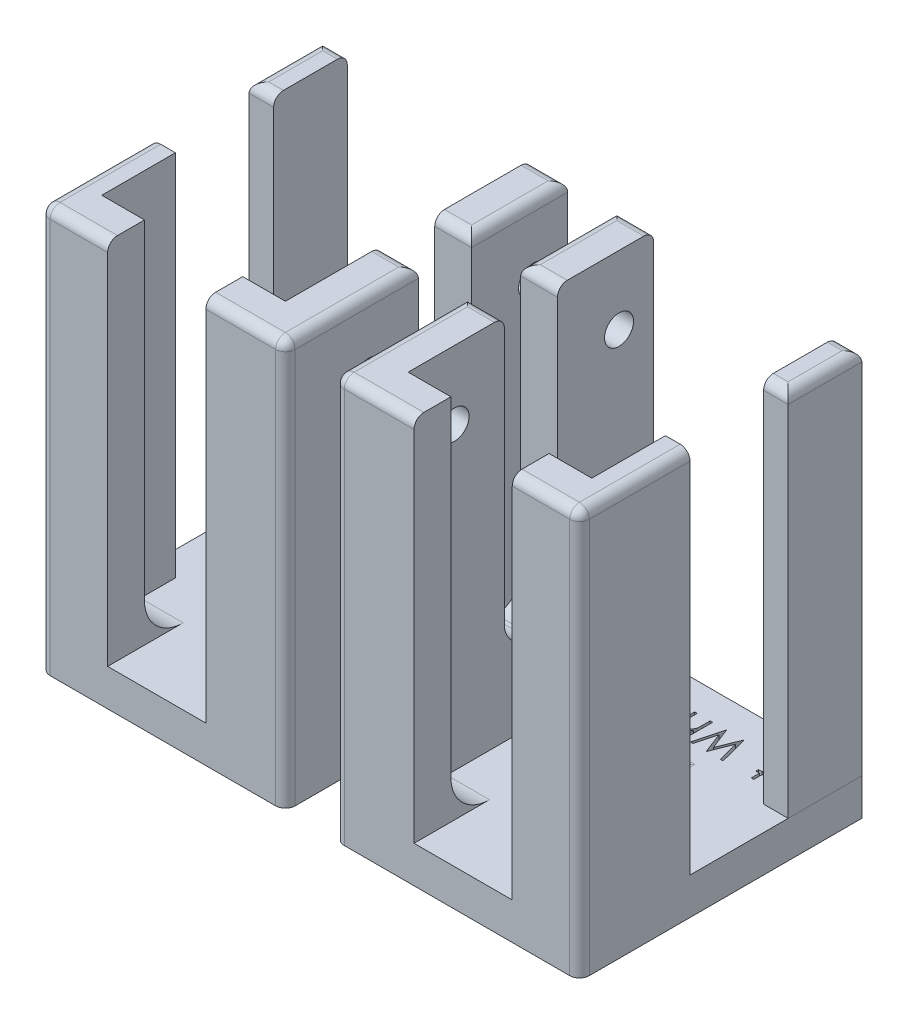
from build123d import *

# Parameters (mm, degrees)
SKETCH2_W             = 2.54
SKETCH2_H             = 7.62
BOSS_EXTRUDE2_DEPTH   = 38.1
BOSS_EXTRUDE2_2_DEPTH = 38.1
SKETCH1_W             = 25.35
SKETCH1_H             = 29.21
BOSS_EXTRUDE3_DEPTH   = 3.81
SKETCH3_W             = 3
SKETCH3_H             = 7.62
CUT_EXTRUDE1_DEPTH    = 44.604428674
SKETCH4_W             = 5.5
SKETCH4_H             = 30.1
CUT_EXTRUDE2_DEPTH    = 47.77779067
SKETCH9_W             = 10.16
SKETCH9_H             = 38.1
CUT_EXTRUDE7_DEPTH    = 3.81
SKETCH5_R             = 1.5
CUT_EXTRUDE3_DEPTH    = 47.77779067
SKETCH6_R             = 1.45
CUT_EXTRUDE4_DEPTH    = 22.054
FILLET1_R             = 4
FILLET4_R             = 2.54
FILLET2_R             = 1.016
FILLET3_R             = 1.27
FILLET5_R             = 1.016
SKETCH7_W             = 0.261191239
SKETCH7_H             = 2.985042735
CUT_EXTRUDE5_DEPTH    = 1.27
SKETCH8_W             = 0.26119124
SKETCH8_H             = 2.985042735
CUT_EXTRUDE6_DEPTH    = 1.27


with BuildPart() as part:
    # Sketch2 → Boss-Extrude2 (new body)
    with BuildSketch(Plane(origin=(0, 0, 0), x_dir=(1, 0, 0), z_dir=(0, 1, 0))):
        with Locations((10.77, -8.89)):
            Rectangle(SKETCH2_W, SKETCH2_H)
    extrude(amount=BOSS_EXTRUDE2_DEPTH)


with BuildPart() as body_2:
    # Sketch2 → Boss-Extrude2 2 (new body)
    with BuildSketch(Plane(origin=(0, 0, 0), x_dir=(1, 0, 0), z_dir=(0, 1, 0))):
        Polygon((-13.31, -12.7), (-13.31, 16.51), (12.04, 16.51), (12.04, 5.08), (9.5, 5.08), (9.5, 12.7), (-9.5, 12.7), (-9.5, -12.7), align=None)
    extrude(amount=BOSS_EXTRUDE2_2_DEPTH)

    # Sketch1 → Boss-Extrude3 (add)
    with BuildSketch(Plane(origin=(0, 0, 0), x_dir=(1, 0, 0), z_dir=(0, 1, 0))):
        with Locations((-0.635, 1.905)):
            Rectangle(SKETCH1_W, SKETCH1_H)
    extrude(amount=-BOSS_EXTRUDE3_DEPTH)

    # Sketch3 → Cut-Extrude1 (cut, through all)
    with BuildSketch(Plane(origin=(0, 0, 0), x_dir=(1, 0, 0), z_dir=(0, 1, 0))):
        with Locations((-0.38, 0)):
            Rectangle(SKETCH3_W, SKETCH3_H)
    extrude(amount=-CUT_EXTRUDE1_DEPTH, mode=Mode.SUBTRACT)

    # Sketch4 → Cut-Extrude2 (cut, through all)
    with BuildSketch(Plane(origin=(-9.5, 0, 0), x_dir=(0, 0, -1), z_dir=(1, 0, 0))):
        with Locations((0, 23.05)):
            Rectangle(SKETCH4_W, SKETCH4_H)
    extrude(amount=-CUT_EXTRUDE2_DEPTH, mode=Mode.SUBTRACT)

    # Sketch9 → Cut-Extrude7 (cut)
    with BuildSketch(Plane.XY.offset(-12.7)):
        with Locations((0, 19.05)):
            Rectangle(SKETCH9_W, SKETCH9_H)
    extrude(amount=-CUT_EXTRUDE7_DEPTH, mode=Mode.SUBTRACT)

    # Sketch5 → Cut-Extrude3 (cut, through all)
    with BuildSketch(Plane(origin=(-9.5, 0, 0), x_dir=(0, 0, -1), z_dir=(1, 0, 0))):
        with Locations((-9.1179944, 31)):
            Circle(SKETCH5_R)
        with Locations((7.9000056, 31)):
            Circle(SKETCH5_R)
    extrude(amount=-CUT_EXTRUDE3_DEPTH, mode=Mode.SUBTRACT)

    # Sketch6 → Cut-Extrude4 (cut)
    with BuildSketch(Plane.XY.offset(12.7)):
        with Locations(Location((-11.405, 19.05, 0), (0, 0, 90))):
            Circle(SKETCH6_R)
        with Locations((-3.81, -1.905)):
            Circle(SKETCH6_R)
    extrude(amount=-CUT_EXTRUDE4_DEPTH, mode=Mode.SUBTRACT)

    # Fillet1
    fillet1_edges = [body_2.edges().sort_by_distance(p)[0] for p in [
        (-7.29, 0, -12.7),
        (7.29, 0, -12.7),
    ]]
    fillet(fillet1_edges, radius=FILLET1_R)


with BuildPart() as body_3:
    # Mirror1: mirrored copy
    add(body_2.part.mirror(Plane.XY))

    # Fillet4
    fillet4_edges = [body_3.edges().sort_by_distance(p)[0] for p in [
        (-11.405, 8, -2.75),
        (-11.405, 8, 2.75),
    ]]
    fillet(fillet4_edges, radius=FILLET4_R)

    # Fillet2
    fillet2_edges = [body_3.edges().sort_by_distance(p)[0] for p in [
        (-13.31, 17.145, 16.51),
        (12.04, 17.145, 16.51),
        (12.04, 38.1, 10.795),
        (8.56, 38.1, 16.51),
        (-13.31, 38.1, 9.63),
        (-11.405, 38.1, -12.7),
        (-13.31, 38.1, -7.725),
        (-11.405, 38.1, -2.75),
        (-11.405, 38.1, 2.75),
        (-9.195, 38.1, 16.51),
    ]]
    fillet(fillet2_edges, radius=FILLET2_R)

    # Fillet3
    fillet3_edges = [body_3.edges().sort_by_distance(p)[0] for p in [
        (-1.88, 0, 0),
        (-0.38, 0, -3.81),
        (1.12, 0, 0),
        (-0.38, 0, 3.81),
    ]]
    fillet(fillet3_edges, radius=FILLET3_R)


with BuildPart() as body_4:
    # Mirror1 2: mirrored copy
    add(part.part.mirror(Plane.XY))

    # Fillet5
    fillet5_edges = [body_4.edges().sort_by_distance(p)[0] for p in [
        (10.77, 38.1, -12.7),
        (12.04, 38.1, -8.89),
        (10.77, 38.1, -5.08),
    ]]
    fillet(fillet5_edges, radius=FILLET5_R)


with BuildPart() as body_3_2:
    # Mirror3: mirrored copy
    add(body_3.part.mirror(Plane.ZY.offset(15.85)))

    # Sketch8 → Cut-Extrude6 (cut)
    # profile 1 of 8: a face of its own
    with BuildSketch(Plane(origin=(0, 0, 0), x_dir=(1, 0, 0), z_dir=(0, 1, 0))):
        with Locations((-40.665007096, 8.312855295)):
            Rectangle(SKETCH8_W, SKETCH8_H)
    # profile 2 of 8: a face of its own
    with BuildSketch(Plane(origin=(0, 0, 0), x_dir=(1, 0, 0), z_dir=(0, 1, 0))):
        with BuildLine():
            Line((-39.705362498, 9.133742047), (-39.937402929, 9.255592424))
            add(Edge.make_bspline(
                [(-39.937402929, 9.255592424), (-39.918899777, 9.288380971), (-39.882899969, 9.352174499), (-39.821288232, 9.439868181), (-39.756031538, 9.518018678), (-39.685833051, 9.58625911), (-39.61157339, 9.646192558), (-39.532146677, 9.697546688), (-39.448874524, 9.742134152), (-39.360549092, 9.778475368), (-39.267254655, 9.807079868), (-39.168416464, 9.828195291), (-39.063577149, 9.840442417), (-38.991782959, 9.841928663), (-38.955020701, 9.842689697)],
                knots=[0, 0, 0, 0, 1.120547187, 2.180141081, 3.186367408, 4.148075574, 5.090720713, 6.023293347, 6.960451315, 7.899733127, 8.862572377, 9.862522039, 10.90550313, 12, 12, 12, 12], degree=3))
            add(Edge.make_bspline(
                [(-38.955020701, 9.842689697), (-38.914156807, 9.841735766), (-38.834443188, 9.839874923), (-38.71840924, 9.823832321), (-38.60916101, 9.797661551), (-38.506704567, 9.761102128), (-38.411291081, 9.713348508), (-38.322729951, 9.655174109), (-38.240559074, 9.586876312), (-38.167354153, 9.507869095), (-38.101490996, 9.423302792), (-38.043229028, 9.335242104), (-37.995084336, 9.243724162), (-37.953990936, 9.150138449), (-37.923585468, 9.053239428), (-37.900884963, 8.953880828), (-37.888165754, 8.851698798), (-37.886184487, 8.782604618), (-37.885186049, 8.74778535)],
                knots=[0, 0, 0, 0, 1.145213001, 2.233978795, 3.276616913, 4.289988888, 5.2768102, 6.260573508, 7.254647871, 8.264498533, 9.273731702, 10.25749501, 11.220258744, 12.169609138, 13.119022067, 14.062790212, 15.023763961, 16, 16, 16, 16], degree=3))
            add(Edge.make_bspline(
                [(-37.885186049, 8.74778535), (-37.886066775, 8.715109827), (-37.887812259, 8.650351256), (-37.898814289, 8.554502467), (-37.918312661, 8.461345474), (-37.945068807, 8.370802871), (-37.979620646, 8.283026256), (-38.021890057, 8.197962207), (-38.071942886, 8.115701243), (-38.110587127, 8.063810066), (-38.130052836, 8.037671668)],
                knots=[0, 0, 0, 0, 1.024358464, 2.0301432, 3.019427413, 4.004406732, 4.986367066, 5.972626655, 6.978780325, 8, 8, 8, 8], degree=3))
            add(Edge.make_bspline(
                [(-38.130052836, 8.037671668), (-38.156373829, 8.006129687), (-38.208097485, 7.944146213), (-38.296488303, 7.863444664), (-38.390910352, 7.794411387), (-38.492313405, 7.738093903), (-38.600526654, 7.694776853), (-38.714991943, 7.663966009), (-38.836025652, 7.644794094), (-38.918995583, 7.642429927), (-38.961433879, 7.64122068)],
                knots=[0, 0, 0, 0, 1.030811313, 2.025658015, 2.997072178, 3.962767568, 4.930766827, 5.917075773, 6.934604948, 8, 8, 8, 8], degree=3))
            add(Edge.make_bspline(
                [(-38.961433879, 7.64122068), (-39.005049068, 7.642340996), (-39.090612127, 7.644538803), (-39.215335547, 7.665096449), (-39.333583204, 7.697301237), (-39.444379259, 7.744222084), (-39.549430916, 7.80238368), (-39.646320423, 7.875897212), (-39.73770746, 7.960986941), (-39.790844921, 8.026492776), (-39.817884617, 8.059826282)],
                knots=[0, 0, 0, 0, 1.056389096, 2.072394598, 3.055233004, 4.020130009, 4.981825462, 5.957811105, 6.960805292, 8, 8, 8, 8], degree=3))
            add(Edge.make_bspline(
                [(-39.817884617, 8.059826282), (-39.83628422, 8.084941998), (-39.872960952, 8.135006253), (-39.918901547, 8.216640245), (-39.958780404, 8.302048995), (-39.990656087, 8.392613093), (-40.01646691, 8.487259494), (-40.035140824, 8.586664812), (-40.046091989, 8.690799447), (-40.048244614, 8.761752541), (-40.049342032, 8.797924739)],
                knots=[0, 0, 0, 0, 0.94817472, 1.890038105, 2.849395472, 3.817997239, 4.812318967, 5.836947057, 6.897266129, 8, 8, 8, 8], degree=3))
            Line((-40.049342032, 8.797924739), (-38.146377288, 8.797924739))
            add(Edge.make_bspline(
                [(-38.146377288, 8.797924739), (-38.14765876, 8.825947713), (-38.150178723, 8.881053762), (-38.161898856, 8.961697642), (-38.18046239, 9.038481281), (-38.206266241, 9.111077524), (-38.238621608, 9.179724727), (-38.277010331, 9.244896), (-38.32308897, 9.305601592), (-38.374399278, 9.362628172), (-38.431540323, 9.413393691), (-38.491633447, 9.458866409), (-38.555467387, 9.496768048), (-38.62239864, 9.527996084), (-38.692774316, 9.552031272), (-38.766495449, 9.568582719), (-38.843332706, 9.579639919), (-38.895707815, 9.580871476), (-38.922371796, 9.581498457)],
                knots=[0, 0, 0, 0, 1.094405546, 2.152104367, 3.174987145, 4.173015398, 5.153654967, 6.133208507, 7.119289451, 8.123438607, 9.122504012, 10.097966803, 11.060604936, 12.014205423, 12.976096155, 13.956823727, 14.959826266, 16, 16, 16, 16], degree=3))
            add(Edge.make_bspline(
                [(-38.922371796, 9.581498457), (-38.948443571, 9.581000421), (-39.000174973, 9.58001222), (-39.077372782, 9.570120525), (-39.153497698, 9.554703325), (-39.227562611, 9.532333059), (-39.298381398, 9.505876924), (-39.364516228, 9.474943489), (-39.425346082, 9.440077658), (-39.482091202, 9.399839098), (-39.536832197, 9.350967774), (-39.591309047, 9.289866002), (-39.649198667, 9.217170419), (-39.685936722, 9.162598001), (-39.705362498, 9.133742047)],
                knots=[0, 0, 0, 0, 0.991026944, 1.966387566, 2.954903586, 3.941705208, 4.905318989, 5.827751054, 6.715113263, 7.568237245, 8.468614997, 9.499196909, 10.677664282, 12, 12, 12, 12], degree=3))
        make_face()
        with BuildLine():
            add(Edge.make_bspline(
                [(-39.788150793, 8.5367335), (-39.778645761, 8.50206325), (-39.760399189, 8.435507634), (-39.721294458, 8.34359198), (-39.679296653, 8.260962923), (-39.62772219, 8.189709881), (-39.569355663, 8.126764921), (-39.501729857, 8.07208942), (-39.427078918, 8.021937854), (-39.344045698, 7.980130261), (-39.255839385, 7.945786563), (-39.16429132, 7.920530282), (-39.070163288, 7.905684576), (-39.006765955, 7.903507933), (-38.974843251, 7.902411919)],
                knots=[0, 0, 0, 0, 1.154958961, 2.217145986, 3.207012531, 4.129872728, 5.036522214, 5.960144231, 6.920619777, 7.92424629, 8.943461387, 9.961007416, 10.973298156, 12, 12, 12, 12], degree=3))
            add(Edge.make_bspline(
                [(-38.974843251, 7.902411919), (-38.948773445, 7.902916797), (-38.897238922, 7.903914834), (-38.821335856, 7.913507062), (-38.748121077, 7.929125126), (-38.677945575, 7.951471136), (-38.610650836, 7.97956989), (-38.545928105, 8.013386526), (-38.484556414, 8.054532588), (-38.446190422, 8.085937697), (-38.426808061, 8.101803445)],
                knots=[0, 0, 0, 0, 1.04879286, 2.073242986, 3.073461291, 4.057960153, 5.032623303, 6.005244481, 6.992256684, 8, 8, 8, 8], degree=3))
            add(Edge.make_bspline(
                [(-38.426808061, 8.101803445), (-38.412924627, 8.114353768), (-38.384827939, 8.139752563), (-38.347325401, 8.183536845), (-38.311150261, 8.230777522), (-38.279003378, 8.283536693), (-38.248452537, 8.340284399), (-38.220612801, 8.401434714), (-38.195299623, 8.467245755), (-38.181089802, 8.513127818), (-38.173779048, 8.5367335)],
                knots=[0, 0, 0, 0, 0.879905587, 1.780714457, 2.708106151, 3.677566983, 4.684151534, 5.740052498, 6.837288539, 8, 8, 8, 8], degree=3))
            Line((-38.173779048, 8.5367335), (-39.788150793, 8.5367335))
        make_face(mode=Mode.SUBTRACT)
    # profile 3 of 8: a face of its own
    with BuildSketch(Plane(origin=(0, 0, 0), x_dir=(1, 0, 0), z_dir=(0, 1, 0))):
        with BuildLine():
            Line((-37.093450105, 9.133742047), (-37.325490536, 9.255592424))
            add(Edge.make_bspline(
                [(-37.325490536, 9.255592424), (-37.306987383, 9.288380971), (-37.270987576, 9.352174499), (-37.209375838, 9.439868181), (-37.144119145, 9.518018678), (-37.073920657, 9.58625911), (-36.999660997, 9.646192558), (-36.920234284, 9.697546688), (-36.836962131, 9.742134152), (-36.748636699, 9.778475368), (-36.655342262, 9.807079868), (-36.556504071, 9.828195291), (-36.451664756, 9.840442417), (-36.379870566, 9.841928663), (-36.343108308, 9.842689697)],
                knots=[0, 0, 0, 0, 1.120547187, 2.180141081, 3.186367408, 4.148075574, 5.090720713, 6.023293347, 6.960451315, 7.899733127, 8.862572377, 9.862522039, 10.90550313, 12, 12, 12, 12], degree=3))
            add(Edge.make_bspline(
                [(-36.343108308, 9.842689697), (-36.302244414, 9.841735766), (-36.222530795, 9.839874923), (-36.106496847, 9.823832321), (-35.997248617, 9.797661551), (-35.894792173, 9.761102128), (-35.799378688, 9.713348508), (-35.710817557, 9.655174109), (-35.628646681, 9.586876312), (-35.55544176, 9.507869095), (-35.489578603, 9.423302792), (-35.431316635, 9.335242104), (-35.383171943, 9.243724162), (-35.342078542, 9.150138449), (-35.311673075, 9.053239428), (-35.288972569, 8.953880828), (-35.276253361, 8.851698798), (-35.274272094, 8.782604618), (-35.273273656, 8.74778535)],
                knots=[0, 0, 0, 0, 1.145213001, 2.233978795, 3.276616913, 4.289988888, 5.2768102, 6.260573508, 7.254647871, 8.264498533, 9.273731702, 10.25749501, 11.220258744, 12.169609138, 13.119022067, 14.062790212, 15.023763961, 16, 16, 16, 16], degree=3))
            add(Edge.make_bspline(
                [(-35.273273656, 8.74778535), (-35.274154382, 8.715109827), (-35.275899866, 8.650351256), (-35.286901896, 8.554502467), (-35.306400268, 8.461345474), (-35.333156413, 8.370802871), (-35.367708253, 8.283026256), (-35.409977664, 8.197962207), (-35.460030493, 8.115701243), (-35.498674734, 8.063810066), (-35.518140443, 8.037671668)],
                knots=[0, 0, 0, 0, 1.024358464, 2.0301432, 3.019427413, 4.004406732, 4.986367066, 5.972626655, 6.978780325, 8, 8, 8, 8], degree=3))
            add(Edge.make_bspline(
                [(-35.518140443, 8.037671668), (-35.544461436, 8.006129687), (-35.596185092, 7.944146213), (-35.68457591, 7.863444664), (-35.778997959, 7.794411387), (-35.880401012, 7.738093903), (-35.988614261, 7.694776853), (-36.10307955, 7.663966009), (-36.224113259, 7.644794094), (-36.30708319, 7.642429927), (-36.349521486, 7.64122068)],
                knots=[0, 0, 0, 0, 1.030811313, 2.025658015, 2.997072178, 3.962767568, 4.930766827, 5.917075773, 6.934604948, 8, 8, 8, 8], degree=3))
            add(Edge.make_bspline(
                [(-36.349521486, 7.64122068), (-36.393136675, 7.642340996), (-36.478699734, 7.644538803), (-36.603423154, 7.665096449), (-36.721670811, 7.697301237), (-36.832466866, 7.744222084), (-36.937518523, 7.80238368), (-37.03440803, 7.875897212), (-37.125795067, 7.960986941), (-37.178932527, 8.026492776), (-37.205972224, 8.059826282)],
                knots=[0, 0, 0, 0, 1.056389096, 2.072394598, 3.055233004, 4.020130009, 4.981825462, 5.957811105, 6.960805292, 8, 8, 8, 8], degree=3))
            add(Edge.make_bspline(
                [(-37.205972224, 8.059826282), (-37.224371826, 8.084941998), (-37.261048559, 8.135006253), (-37.306989153, 8.216640245), (-37.346868011, 8.302048995), (-37.378743694, 8.392613093), (-37.404554517, 8.487259494), (-37.423228431, 8.586664812), (-37.434179596, 8.690799447), (-37.436332221, 8.761752541), (-37.437429639, 8.797924739)],
                knots=[0, 0, 0, 0, 0.94817472, 1.890038105, 2.849395472, 3.817997239, 4.812318967, 5.836947057, 6.897266129, 8, 8, 8, 8], degree=3))
            Line((-37.437429639, 8.797924739), (-35.534464895, 8.797924739))
            add(Edge.make_bspline(
                [(-35.534464895, 8.797924739), (-35.535746367, 8.825947713), (-35.53826633, 8.881053762), (-35.549986463, 8.961697642), (-35.568549997, 9.038481281), (-35.594353848, 9.111077524), (-35.626709214, 9.179724727), (-35.665097937, 9.244896), (-35.711176577, 9.305601592), (-35.762486885, 9.362628172), (-35.81962793, 9.413393691), (-35.879721054, 9.458866409), (-35.943554994, 9.496768048), (-36.010486247, 9.527996084), (-36.080861923, 9.552031272), (-36.154583056, 9.568582719), (-36.231420313, 9.579639919), (-36.283795422, 9.580871476), (-36.310459403, 9.581498457)],
                knots=[0, 0, 0, 0, 1.094405546, 2.152104367, 3.174987145, 4.173015398, 5.153654967, 6.133208507, 7.119289451, 8.123438607, 9.122504012, 10.097966803, 11.060604936, 12.014205423, 12.976096155, 13.956823727, 14.959826266, 16, 16, 16, 16], degree=3))
            add(Edge.make_bspline(
                [(-36.310459403, 9.581498457), (-36.336531178, 9.581000421), (-36.38826258, 9.58001222), (-36.465460389, 9.570120525), (-36.541585305, 9.554703325), (-36.615650218, 9.532333059), (-36.686469005, 9.505876924), (-36.752603835, 9.474943489), (-36.813433689, 9.440077658), (-36.870178809, 9.399839098), (-36.924919803, 9.350967774), (-36.979396654, 9.289866002), (-37.037286274, 9.217170419), (-37.074024328, 9.162598001), (-37.093450105, 9.133742047)],
                knots=[0, 0, 0, 0, 0.991026944, 1.966387566, 2.954903586, 3.941705208, 4.905318989, 5.827751054, 6.715113263, 7.568237245, 8.468614997, 9.499196909, 10.677664282, 12, 12, 12, 12], degree=3))
        make_face()
        with BuildLine():
            add(Edge.make_bspline(
                [(-37.176238399, 8.5367335), (-37.166733368, 8.50206325), (-37.148486796, 8.435507634), (-37.109382065, 8.34359198), (-37.06738426, 8.260962923), (-37.015809797, 8.189709881), (-36.95744327, 8.126764921), (-36.889817464, 8.07208942), (-36.815166525, 8.021937854), (-36.732133305, 7.980130261), (-36.643926992, 7.945786563), (-36.552378927, 7.920530282), (-36.458250895, 7.905684576), (-36.394853562, 7.903507933), (-36.362930857, 7.902411919)],
                knots=[0, 0, 0, 0, 1.154958961, 2.217145986, 3.207012531, 4.129872728, 5.036522214, 5.960144231, 6.920619777, 7.92424629, 8.943461387, 9.961007416, 10.973298156, 12, 12, 12, 12], degree=3))
            add(Edge.make_bspline(
                [(-36.362930857, 7.902411919), (-36.336861052, 7.902916797), (-36.285326529, 7.903914834), (-36.209423463, 7.913507062), (-36.136208684, 7.929125126), (-36.066033182, 7.951471136), (-35.998738443, 7.97956989), (-35.934015712, 8.013386526), (-35.872644021, 8.054532588), (-35.834278029, 8.085937697), (-35.814895668, 8.101803445)],
                knots=[0, 0, 0, 0, 1.04879286, 2.073242986, 3.073461291, 4.057960153, 5.032623303, 6.005244481, 6.992256684, 8, 8, 8, 8], degree=3))
            add(Edge.make_bspline(
                [(-35.814895668, 8.101803445), (-35.801012233, 8.114353768), (-35.772915546, 8.139752563), (-35.735413008, 8.183536845), (-35.699237868, 8.230777522), (-35.667090984, 8.283536693), (-35.636540144, 8.340284399), (-35.608700407, 8.401434714), (-35.58338723, 8.467245755), (-35.569177409, 8.513127818), (-35.561866655, 8.5367335)],
                knots=[0, 0, 0, 0, 0.879905587, 1.780714457, 2.708106151, 3.677566983, 4.684151534, 5.740052498, 6.837288539, 8, 8, 8, 8], degree=3))
            Line((-35.561866655, 8.5367335), (-37.176238399, 8.5367335))
        make_face(mode=Mode.SUBTRACT)
    # profile 4 of 8: a face of its own
    with BuildSketch(Plane(origin=(0, 0, 0), x_dir=(1, 0, 0), z_dir=(0, 1, 0))):
        with BuildLine():
            Line((-32.885239468, 6.820333927), (-33.146430707, 6.820333927))
            Line((-33.146430707, 6.820333927), (-33.146430707, 8.080231847))
            add(Edge.make_bspline(
                [(-33.146430707, 8.080231847), (-33.174512892, 8.045235849), (-33.229103586, 7.977204965), (-33.320362505, 7.887481712), (-33.415454965, 7.811058838), (-33.515187957, 7.748652234), (-33.61913761, 7.700239868), (-33.727559356, 7.666370299), (-33.84017678, 7.645249988), (-33.916891622, 7.642573275), (-33.955657136, 7.64122068)],
                knots=[0, 0, 0, 0, 1.12556596, 2.18805719, 3.205172764, 4.182516927, 5.13416184, 6.075333115, 7.027428072, 8, 8, 8, 8], degree=3))
            add(Edge.make_bspline(
                [(-33.955657136, 7.64122068), (-33.995033594, 7.642589914), (-34.072141454, 7.64527118), (-34.184006067, 7.668896527), (-34.289215324, 7.706284047), (-34.386363839, 7.758829447), (-34.473951511, 7.824071211), (-34.549919652, 7.900588562), (-34.613648507, 7.987373695), (-34.656287833, 8.068267571), (-34.684233727, 8.140205623), (-34.701899055, 8.201942229), (-34.716884886, 8.270727786), (-34.729939347, 8.34653611), (-34.738640501, 8.429728279), (-34.745629285, 8.519929834), (-34.750599008, 8.61713534), (-34.750791596, 8.684424383), (-34.750891177, 8.719217558)],
                knots=[0, 0, 0, 0, 1.235689485, 2.419754739, 3.574485241, 4.732583367, 5.875375667, 6.993392835, 8.106934443, 9.24564317, 9.854426656, 10.528623913, 11.260290605, 12.06517837, 12.94359002, 13.886555271, 14.907200199, 16, 16, 16, 16], degree=3))
            Line((-34.750891177, 8.719217558), (-34.750891177, 9.805376662))
            Line((-34.750891177, 9.805376662), (-34.489699938, 9.805376662))
            Line((-34.489699938, 9.805376662), (-34.489699938, 8.804920933))
            add(Edge.make_bspline(
                [(-34.489699938, 8.804920933), (-34.489542324, 8.775964188), (-34.489240837, 8.720574863), (-34.488231988, 8.641273885), (-34.486031141, 8.569540632), (-34.482343194, 8.505226197), (-34.478632258, 8.44841774), (-34.473371117, 8.399022469), (-34.46729559, 8.357350257), (-34.461832984, 8.332266956), (-34.459383098, 8.321017521)],
                knots=[0, 0, 0, 0, 1.430934443, 2.737134061, 3.918973087, 4.976914145, 5.92044225, 6.731742364, 7.431207999, 8, 8, 8, 8], degree=3))
            add(Edge.make_bspline(
                [(-34.459383098, 8.321017521), (-34.449927398, 8.28798562), (-34.431796895, 8.22464975), (-34.388814032, 8.138770515), (-34.336378005, 8.064885376), (-34.271384111, 8.005092895), (-34.195991472, 7.957980086), (-34.109484334, 7.925882104), (-34.012968101, 7.905412871), (-33.945081745, 7.903442036), (-33.90959886, 7.902411919)],
                knots=[0, 0, 0, 0, 1.090171874, 2.090312098, 3.036871164, 3.954896932, 4.878889889, 5.844924892, 6.87358393, 8, 8, 8, 8], degree=3))
            add(Edge.make_bspline(
                [(-33.90959886, 7.902411919), (-33.888585635, 7.902801896), (-33.847001006, 7.90357365), (-33.785370099, 7.911518063), (-33.72539959, 7.924065193), (-33.66725044, 7.942598421), (-33.610804033, 7.965131322), (-33.555830918, 7.992783699), (-33.503083438, 8.026218399), (-33.451880775, 8.063848822), (-33.40421613, 8.105478017), (-33.359872712, 8.14942438), (-33.320342157, 8.196219273), (-33.284528615, 8.24511448), (-33.253613089, 8.296779996), (-33.226626809, 8.350717773), (-33.203729565, 8.406998698), (-33.192351755, 8.446060699), (-33.186658822, 8.465605529)],
                knots=[0, 0, 0, 0, 1.024369801, 2.02720137, 3.025498567, 4.008789058, 4.999724648, 5.987391013, 7.005161842, 8.042127274, 9.083588116, 10.088924978, 11.084112559, 12.068088063, 13.041783903, 14.016724555, 15.007660144, 16, 16, 16, 16], degree=3))
            add(Edge.make_bspline(
                [(-33.186658822, 8.465605529), (-33.183383001, 8.47975926), (-33.176244583, 8.510601982), (-33.168498855, 8.561471346), (-33.161565581, 8.620583049), (-33.155704376, 8.687847435), (-33.152109524, 8.763510986), (-33.148235975, 8.847057373), (-33.146794059, 8.939009926), (-33.146555444, 9.002952202), (-33.146430707, 9.036378349)],
                knots=[0, 0, 0, 0, 0.607992626, 1.324890765, 2.152360218, 3.099583803, 4.150613268, 5.323148443, 6.60066238, 8, 8, 8, 8], degree=3))
            Line((-33.146430707, 9.036378349), (-33.146430707, 9.805376662))
            Line((-33.146430707, 9.805376662), (-32.885239468, 9.805376662))
            Line((-32.885239468, 9.805376662), (-32.885239468, 6.820333927))
        make_face()
    # profile 5 of 8: a face of its own
    with BuildSketch(Plane(origin=(0, 0, 0), x_dir=(1, 0, 0), z_dir=(0, 1, 0))):
        Polygon((-28.89274481, 6.894959996), (-29.162681291, 6.894959996), (-29.732288079, 9.029382155), (-30.579410558, 6.894959996), (-30.617306609, 6.894959996), (-31.448687652, 9.014806751), (-32.02120952, 6.894959996), (-32.288230921, 6.894959996), (-31.503491171, 9.805376662), (-31.466178136, 9.805376662), (-30.590487865, 7.579420967), (-29.704303303, 9.805376662), (-29.666990269, 9.805376662), align=None)
    # profile 6 of 8: a face of its own
    with BuildSketch(Plane(origin=(0, 0, 0), x_dir=(1, 0, 0), z_dir=(0, 1, 0))):
        with BuildLine():
            add(Edge.make_bspline(
                [(-27.045749617, 9.357620252), (-27.061967874, 9.358551499), (-27.093574948, 9.360366365), (-27.139342947, 9.373704732), (-27.181166637, 9.396210396), (-27.218190709, 9.427133409), (-27.248962457, 9.46405128), (-27.271727081, 9.505768726), (-27.285676841, 9.551669412), (-27.287401154, 9.583732425), (-27.28828434, 9.600154974)],
                knots=[0, 0, 0, 0, 1.020591893, 1.988988293, 2.974634352, 3.991697318, 5.008760285, 5.983632262, 6.967224335, 8, 8, 8, 8], degree=3))
            add(Edge.make_bspline(
                [(-27.28828434, 9.600154974), (-27.287368954, 9.616185394), (-27.285560712, 9.647851717), (-27.271720543, 9.693365143), (-27.248991319, 9.735129951), (-27.21799586, 9.771960459), (-27.181390352, 9.803627705), (-27.13921036, 9.825821102), (-27.09369295, 9.840136912), (-27.061989143, 9.841825009), (-27.045749617, 9.842689697)],
                knots=[0, 0, 0, 0, 1.010056097, 1.99525427, 2.971718109, 3.990441831, 5.01702829, 6.004283803, 6.977741589, 8, 8, 8, 8], degree=3))
            add(Edge.make_bspline(
                [(-27.045749617, 9.842689697), (-27.029521779, 9.841792438), (-26.997654416, 9.840030449), (-26.951966671, 9.826105716), (-26.910042211, 9.803411144), (-26.873427188, 9.77201761), (-26.842680885, 9.734938153), (-26.818896451, 9.693649494), (-26.806160539, 9.64772009), (-26.804206032, 9.616159467), (-26.803214895, 9.600154974)],
                knots=[0, 0, 0, 0, 1.021821805, 2.006599202, 2.982645994, 4.008793999, 5.027082625, 6.009034913, 6.990375297, 8, 8, 8, 8], degree=3))
            add(Edge.make_bspline(
                [(-26.803214895, 9.600154974), (-26.804176508, 9.583759269), (-26.806050743, 9.551803164), (-26.818890658, 9.505484637), (-26.8427098, 9.464243278), (-26.873232984, 9.427076705), (-26.910263666, 9.39642355), (-26.951836606, 9.373424057), (-26.997770572, 9.360471311), (-27.029542578, 9.358583323), (-27.045749617, 9.357620252)],
                knots=[0, 0, 0, 0, 1.032329927, 2.012066096, 2.992413168, 4.009037178, 5.025661188, 6.000112418, 6.979848586, 8, 8, 8, 8], degree=3))
        make_face()
    # profile 7 of 8: a face of its own
    with BuildSketch(Plane(origin=(0, 0, 0), x_dir=(1, 0, 0), z_dir=(0, 1, 0))):
        Polygon((-25.646510835, 6.820333927), (-25.907702075, 6.820333927), (-25.907702075, 7.678533714), (-26.280832417, 7.678533714), (-26.280832417, 7.939724953), (-25.907702075, 7.939724953), (-25.907702075, 9.805376662), (-25.646510835, 9.805376662), (-25.646510835, 7.939724953), (-25.273380493, 7.939724953), (-25.273380493, 7.678533714), (-25.646510835, 7.678533714), align=None)
    # profile 8 of 8: a face of its own
    with BuildSketch(Plane(origin=(0, 0, 0), x_dir=(1, 0, 0), z_dir=(0, 1, 0))):
        with BuildLine():
            Line((-22.997285408, 6.894959996), (-23.579718551, 6.894959996))
            add(Edge.make_bspline(
                [(-23.579718551, 6.894959996), (-23.618586025, 6.895089373), (-23.693215881, 6.895337791), (-23.800130678, 6.896722953), (-23.897277972, 6.900693057), (-23.984606969, 6.90410954), (-24.062116068, 6.910339446), (-24.13004294, 6.916293865), (-24.188074734, 6.92408851), (-24.223204171, 6.931327484), (-24.239109827, 6.934605095)],
                knots=[0, 0, 0, 0, 1.410062039, 2.707475311, 3.878576406, 4.937260626, 5.877586885, 6.699081471, 7.410979367, 8, 8, 8, 8], degree=3))
            add(Edge.make_bspline(
                [(-24.239109827, 6.934605095), (-24.260403313, 6.939865519), (-24.302536037, 6.950274148), (-24.363192289, 6.972285017), (-24.421015949, 6.997715513), (-24.475795265, 7.027812712), (-24.527515882, 7.062068386), (-24.57617259, 7.100620243), (-24.621112998, 7.143798594), (-24.663936016, 7.189814822), (-24.701328691, 7.240672417), (-24.734992018, 7.293790491), (-24.763251227, 7.350191699), (-24.785488072, 7.409591566), (-24.804129869, 7.471407409), (-24.816658898, 7.536250054), (-24.824462196, 7.603908534), (-24.825233162, 7.64994408), (-24.825624083, 7.673286568)],
                knots=[0, 0, 0, 0, 1.027276577, 2.032638556, 3.019345632, 3.985365262, 4.957888996, 5.923693931, 6.890056973, 7.876427719, 8.865527834, 9.843495157, 10.821038291, 11.815616373, 12.812734995, 13.843357168, 14.906466538, 16, 16, 16, 16], degree=3))
            add(Edge.make_bspline(
                [(-24.825624083, 7.673286568), (-24.824402573, 7.712065923), (-24.82201909, 7.787734489), (-24.799795451, 7.897548777), (-24.76339481, 7.999988837), (-24.713227157, 8.094912109), (-24.649370184, 8.180518291), (-24.572628623, 8.255454678), (-24.483394388, 8.318741871), (-24.399933155, 8.362162463), (-24.326172899, 8.390101134), (-24.265270626, 8.409857568), (-24.198786096, 8.424864488), (-24.127673129, 8.438503682), (-24.051382443, 8.448911483), (-23.970067669, 8.456302999), (-23.883525432, 8.461055801), (-23.824203023, 8.461750205), (-23.793685481, 8.462107432)],
                knots=[0, 0, 0, 0, 1.260402266, 2.459371274, 3.627181936, 4.786749125, 5.93865593, 7.087644312, 8.261344208, 9.485713728, 10.136162886, 10.825977872, 11.566646758, 12.35154167, 13.181268117, 14.0701832, 15.007234106, 16, 16, 16, 16], degree=3))
            Line((-23.793685481, 8.462107432), (-24.862937117, 9.805376662))
            Line((-24.862937117, 9.805376662), (-24.539946165, 9.805376662))
            Line((-24.539946165, 9.805376662), (-23.470694529, 8.462107432))
            Line((-23.470694529, 8.462107432), (-23.258476647, 8.462107432))
            Line((-23.258476647, 8.462107432), (-23.258476647, 9.805376662))
            Line((-23.258476647, 9.805376662), (-22.997285408, 9.805376662))
            Line((-22.997285408, 9.805376662), (-22.997285408, 6.894959996))
        make_face()
        with BuildLine():
            Line((-23.258476647, 7.193464269), (-23.258476647, 8.163603158))
            Line((-23.258476647, 8.163603158), (-23.791353417, 8.167684271))
            add(Edge.make_bspline(
                [(-23.791353417, 8.167684271), (-23.816233357, 8.167695285), (-23.864457768, 8.167716631), (-23.934225123, 8.164395531), (-23.999185861, 8.160617836), (-24.059090694, 8.154838153), (-24.113969079, 8.147393945), (-24.163784767, 8.138067719), (-24.208647845, 8.127248232), (-24.260804708, 8.110331129), (-24.319715971, 8.084684703), (-24.382419086, 8.044917692), (-24.437251164, 7.996825353), (-24.482837983, 7.941137005), (-24.519453367, 7.87964556), (-24.544886014, 7.81374266), (-24.561645979, 7.74446667), (-24.563493179, 7.696900387), (-24.564432844, 7.672703552)],
                knots=[0, 0, 0, 0, 1.146399208, 2.222048177, 3.218135709, 4.144938032, 4.994811973, 5.769438708, 6.479732432, 7.119818093, 8.294689872, 9.430121864, 10.527913442, 11.641375077, 12.733452768, 13.811150417, 14.886538365, 16, 16, 16, 16], degree=3))
            add(Edge.make_bspline(
                [(-24.564432844, 7.672703552), (-24.5634456, 7.649293759), (-24.561489243, 7.60290409), (-24.545152869, 7.535143658), (-24.518478156, 7.470712381), (-24.481967322, 7.410496874), (-24.436525673, 7.356241853), (-24.383596386, 7.309962242), (-24.324425004, 7.27151446), (-24.269569284, 7.246146521), (-24.220179817, 7.231219985), (-24.177495196, 7.22038483), (-24.128844722, 7.212796378), (-24.074801004, 7.205817029), (-24.015126632, 7.19990659), (-23.949785242, 7.195983532), (-23.878823552, 7.193638714), (-23.829640076, 7.193523771), (-23.804179772, 7.193464269)],
                knots=[0, 0, 0, 0, 1.100596872, 2.180981401, 3.259506136, 4.371595435, 5.481727359, 6.576991111, 7.667816242, 8.793363246, 9.406619729, 10.09427138, 10.864108636, 11.721733836, 12.6590937, 13.685439239, 14.801845161, 16, 16, 16, 16], degree=3))
            Line((-23.804179772, 7.193464269), (-23.258476647, 7.193464269))
        make_face(mode=Mode.SUBTRACT)
    extrude(amount=-CUT_EXTRUDE6_DEPTH, mode=Mode.SUBTRACT)


with BuildPart() as body_4_2:
    # Mirror3 2: mirrored copy
    add(body_4.part.mirror(Plane.ZY.offset(15.85)))


with BuildPart() as body_3_1:
    add(body_3.part)

    # Sketch7 → Cut-Extrude5 (cut)
    # profile 1 of 8: a face of its own
    with BuildSketch(Plane(origin=(0, 0, 0), x_dir=(1, 0, 0), z_dir=(0, 1, 0))):
        Polygon((8.822853296, 6.86371087), (8.561662057, 6.86371087), (8.561662057, 9.475623264), (7.442271031, 9.475623264), (7.442271031, 9.774127537), (8.822853296, 9.774127537), align=None)
    # profile 2 of 8: a face of its own
    with BuildSketch(Plane(origin=(0, 0, 0), x_dir=(1, 0, 0), z_dir=(0, 1, 0))):
        Polygon((6.770636416, 6.789084802), (6.509445177, 6.789084802), (6.509445177, 7.647284588), (6.136314835, 7.647284588), (6.136314835, 7.908475828), (6.509445177, 7.908475828), (6.509445177, 9.774127537), (6.770636416, 9.774127537), (6.770636416, 7.908475828), (7.143766758, 7.908475828), (7.143766758, 7.647284588), (6.770636416, 7.647284588), align=None)
    # profile 3 of 8: a face of its own
    with BuildSketch(Plane(origin=(0, 0, 0), x_dir=(1, 0, 0), z_dir=(0, 1, 0))):
        with BuildLine():
            add(Edge.make_bspline(
                [(5.371397634, 9.326371127), (5.355179377, 9.327302373), (5.323572303, 9.32911724), (5.277804304, 9.342455606), (5.235980615, 9.364961271), (5.198956542, 9.395884284), (5.168184794, 9.432802154), (5.145420171, 9.4745196), (5.13147041, 9.520420287), (5.129746098, 9.552483299), (5.128862912, 9.568905849)],
                knots=[0, 0, 0, 0, 1.020591893, 1.988988293, 2.974634352, 3.991697318, 5.008760285, 5.983632262, 6.967224335, 8, 8, 8, 8], degree=3))
            add(Edge.make_bspline(
                [(5.128862912, 9.568905849), (5.129778297, 9.584936269), (5.13158654, 9.616602592), (5.145426708, 9.662116017), (5.168155932, 9.703880825), (5.199151391, 9.740711334), (5.2357569, 9.772378579), (5.277936891, 9.794571977), (5.323454301, 9.808887787), (5.355158108, 9.810575884), (5.371397634, 9.811440571)],
                knots=[0, 0, 0, 0, 1.010056097, 1.99525427, 2.971718109, 3.990441831, 5.01702829, 6.004283803, 6.977741589, 8, 8, 8, 8], degree=3))
            add(Edge.make_bspline(
                [(5.371397634, 9.811440571), (5.387625472, 9.810543313), (5.419492836, 9.808781324), (5.46518058, 9.79485659), (5.50710504, 9.772162018), (5.543720064, 9.740768484), (5.574466366, 9.703689027), (5.5982508, 9.662400368), (5.610986712, 9.616470964), (5.612941219, 9.584910341), (5.613932356, 9.568905849)],
                knots=[0, 0, 0, 0, 1.021821805, 2.006599202, 2.982645994, 4.008793999, 5.027082625, 6.009034913, 6.990375297, 8, 8, 8, 8], degree=3))
            add(Edge.make_bspline(
                [(5.613932356, 9.568905849), (5.612970743, 9.552510143), (5.611096508, 9.520554039), (5.598256594, 9.474235512), (5.574437451, 9.432994152), (5.543914268, 9.39582758), (5.506883586, 9.365174424), (5.465310645, 9.342174931), (5.41937668, 9.329222185), (5.387604673, 9.327334198), (5.371397634, 9.326371127)],
                knots=[0, 0, 0, 0, 1.032329927, 2.012066096, 2.992413168, 4.009037178, 5.025661188, 6.000112418, 6.979848586, 8, 8, 8, 8], degree=3))
        make_face()
    # profile 4 of 8: a face of its own
    with BuildSketch(Plane(origin=(0, 0, 0), x_dir=(1, 0, 0), z_dir=(0, 1, 0))):
        Polygon((3.524402442, 6.86371087), (3.25446596, 6.86371087), (2.684859172, 8.998133029), (1.837736693, 6.86371087), (1.799840643, 6.86371087), (0.9684596, 8.983557625), (0.395937731, 6.86371087), (0.12891633, 6.86371087), (0.913656081, 9.774127537), (0.950969115, 9.774127537), (1.826659386, 7.548171841), (2.712843948, 9.774127537), (2.750156982, 9.774127537), align=None)
    # profile 5 of 8: a face of its own
    with BuildSketch(Plane(origin=(0, 0, 0), x_dir=(1, 0, 0), z_dir=(0, 1, 0))):
        with BuildLine():
            Line((-0.468092217, 6.789084802), (-0.729283456, 6.789084802))
            Line((-0.729283456, 6.789084802), (-0.729283456, 8.048982722))
            add(Edge.make_bspline(
                [(-0.729283456, 8.048982722), (-0.757365641, 8.013986723), (-0.811956335, 7.94595584), (-0.903215253, 7.856232587), (-0.998307714, 7.779809713), (-1.098040705, 7.717403109), (-1.201990359, 7.668990742), (-1.310412105, 7.635121173), (-1.423029529, 7.614000862), (-1.499744371, 7.61132415), (-1.538509885, 7.609971554)],
                knots=[0, 0, 0, 0, 1.12556596, 2.18805719, 3.205172764, 4.182516927, 5.13416184, 6.075333115, 7.027428072, 8, 8, 8, 8], degree=3))
            add(Edge.make_bspline(
                [(-1.538509885, 7.609971554), (-1.577886343, 7.611340789), (-1.654994203, 7.614022054), (-1.766858815, 7.637647401), (-1.872068073, 7.675034922), (-1.969216587, 7.727580322), (-2.05680426, 7.792822085), (-2.132772401, 7.869339436), (-2.196501255, 7.956124569), (-2.239140582, 8.037018445), (-2.267086476, 8.108956497), (-2.284751804, 8.170693104), (-2.299737635, 8.239478661), (-2.312792096, 8.315286984), (-2.32149325, 8.398479154), (-2.328482034, 8.488680708), (-2.333451757, 8.585886215), (-2.333644345, 8.653175257), (-2.333743926, 8.687968432)],
                knots=[0, 0, 0, 0, 1.235689485, 2.419754739, 3.574485241, 4.732583367, 5.875375667, 6.993392835, 8.106934443, 9.24564317, 9.854426656, 10.528623913, 11.260290605, 12.06517837, 12.94359002, 13.886555271, 14.907200199, 16, 16, 16, 16], degree=3))
            Line((-2.333743926, 8.687968432), (-2.333743926, 9.774127537))
            Line((-2.333743926, 9.774127537), (-2.072552687, 9.774127537))
            Line((-2.072552687, 9.774127537), (-2.072552687, 8.773671808))
            add(Edge.make_bspline(
                [(-2.072552687, 8.773671808), (-2.072395073, 8.744715063), (-2.072093585, 8.689325737), (-2.071084737, 8.61002476), (-2.06888389, 8.538291507), (-2.065195943, 8.473977072), (-2.061485006, 8.417168614), (-2.056223866, 8.367773343), (-2.050148339, 8.326101132), (-2.044685732, 8.30101783), (-2.042235846, 8.289768396)],
                knots=[0, 0, 0, 0, 1.430934443, 2.737134061, 3.918973087, 4.976914145, 5.92044225, 6.731742364, 7.431207999, 8, 8, 8, 8], degree=3))
            add(Edge.make_bspline(
                [(-2.042235846, 8.289768396), (-2.032780146, 8.256736494), (-2.014649644, 8.193400625), (-1.971666781, 8.10752139), (-1.919230753, 8.033636251), (-1.85423686, 7.97384377), (-1.778844221, 7.926730961), (-1.692337083, 7.894632979), (-1.59582085, 7.874163745), (-1.527934494, 7.872192911), (-1.492451608, 7.871162793)],
                knots=[0, 0, 0, 0, 1.090171874, 2.090312098, 3.036871164, 3.954896932, 4.878889889, 5.844924892, 6.87358393, 8, 8, 8, 8], degree=3))
            add(Edge.make_bspline(
                [(-1.492451608, 7.871162793), (-1.471438384, 7.87155277), (-1.429853755, 7.872324524), (-1.368222847, 7.880268938), (-1.308252339, 7.892816067), (-1.250103189, 7.911349295), (-1.193656781, 7.933882196), (-1.138683667, 7.961534574), (-1.085936186, 7.994969274), (-1.034733524, 8.032599697), (-0.987068879, 8.074228892), (-0.942725461, 8.118175254), (-0.903194906, 8.164970148), (-0.867381364, 8.213865355), (-0.836465838, 8.26553087), (-0.809479558, 8.319468648), (-0.786582314, 8.375749573), (-0.775204504, 8.414811574), (-0.769511571, 8.434356403)],
                knots=[0, 0, 0, 0, 1.024369801, 2.02720137, 3.025498567, 4.008789058, 4.999724648, 5.987391013, 7.005161842, 8.042127274, 9.083588116, 10.088924978, 11.084112559, 12.068088063, 13.041783903, 14.016724555, 15.007660144, 16, 16, 16, 16], degree=3))
            add(Edge.make_bspline(
                [(-0.769511571, 8.434356403), (-0.76623575, 8.448510134), (-0.759097332, 8.479352857), (-0.751351604, 8.53022222), (-0.744418329, 8.589333924), (-0.738557125, 8.65659831), (-0.734962272, 8.732261861), (-0.731088723, 8.815808247), (-0.729646808, 8.9077608), (-0.729408193, 8.971703076), (-0.729283456, 9.005129223)],
                knots=[0, 0, 0, 0, 0.607992626, 1.324890765, 2.152360218, 3.099583803, 4.150613268, 5.323148443, 6.60066238, 8, 8, 8, 8], degree=3))
            Line((-0.729283456, 9.005129223), (-0.729283456, 9.774127537))
            Line((-0.729283456, 9.774127537), (-0.468092217, 9.774127537))
            Line((-0.468092217, 9.774127537), (-0.468092217, 6.789084802))
        make_face()
    # profile 6 of 8: a face of its own
    with BuildSketch(Plane(origin=(0, 0, 0), x_dir=(1, 0, 0), z_dir=(0, 1, 0))):
        with BuildLine():
            Line((-4.676302854, 9.102492922), (-4.908343285, 9.224343299))
            add(Edge.make_bspline(
                [(-4.908343285, 9.224343299), (-4.889840132, 9.257131846), (-4.853840324, 9.320925373), (-4.792228587, 9.408619056), (-4.726971893, 9.486769552), (-4.656773406, 9.555009985), (-4.582513745, 9.614943433), (-4.503087033, 9.666297562), (-4.41981488, 9.710885027), (-4.331489447, 9.747226242), (-4.23819501, 9.775830742), (-4.13935682, 9.796946165), (-4.034517505, 9.809193291), (-3.962723315, 9.810679538), (-3.925961057, 9.811440571)],
                knots=[0, 0, 0, 0, 1.120547187, 2.180141081, 3.186367408, 4.148075574, 5.090720713, 6.023293347, 6.960451315, 7.899733127, 8.862572377, 9.862522039, 10.90550313, 12, 12, 12, 12], degree=3))
            add(Edge.make_bspline(
                [(-3.925961057, 9.811440571), (-3.885097163, 9.81048664), (-3.805383543, 9.808625797), (-3.689349595, 9.792583196), (-3.580101365, 9.766412426), (-3.477644922, 9.729853002), (-3.382231436, 9.682099383), (-3.293670306, 9.623924984), (-3.211499429, 9.555627187), (-3.138294509, 9.47661997), (-3.072431351, 9.392053667), (-3.014169384, 9.303992978), (-2.966024691, 9.212475037), (-2.924931291, 9.118889324), (-2.894525823, 9.021990303), (-2.871825318, 8.922631703), (-2.85910611, 8.820449673), (-2.857124843, 8.751355493), (-2.856126405, 8.716536224)],
                knots=[0, 0, 0, 0, 1.145213001, 2.233978795, 3.276616913, 4.289988888, 5.2768102, 6.260573508, 7.254647871, 8.264498533, 9.273731702, 10.25749501, 11.220258744, 12.169609138, 13.119022067, 14.062790212, 15.023763961, 16, 16, 16, 16], degree=3))
            add(Edge.make_bspline(
                [(-2.856126405, 8.716536224), (-2.857007131, 8.683860702), (-2.858752615, 8.619102131), (-2.869754644, 8.523253342), (-2.889253017, 8.430096349), (-2.916009162, 8.339553745), (-2.950561002, 8.25177713), (-2.992830413, 8.166713082), (-3.042883241, 8.084452118), (-3.081527483, 8.03256094), (-3.100993191, 8.006422542)],
                knots=[0, 0, 0, 0, 1.024358464, 2.0301432, 3.019427413, 4.004406732, 4.986367066, 5.972626655, 6.978780325, 8, 8, 8, 8], degree=3))
            add(Edge.make_bspline(
                [(-3.100993191, 8.006422542), (-3.127314184, 7.974880562), (-3.179037841, 7.912897088), (-3.267428659, 7.832195538), (-3.361850708, 7.763162261), (-3.463253761, 7.706844777), (-3.57146701, 7.663527728), (-3.685932299, 7.632716883), (-3.806966007, 7.613544969), (-3.889935939, 7.611180802), (-3.932374234, 7.609971554)],
                knots=[0, 0, 0, 0, 1.030811313, 2.025658015, 2.997072178, 3.962767568, 4.930766827, 5.917075773, 6.934604948, 8, 8, 8, 8], degree=3))
            add(Edge.make_bspline(
                [(-3.932374234, 7.609971554), (-3.975989424, 7.611091871), (-4.061552482, 7.613289677), (-4.186275903, 7.633847324), (-4.30452356, 7.666052112), (-4.415319614, 7.712972959), (-4.520371271, 7.771134554), (-4.617260779, 7.844648087), (-4.708647816, 7.929737816), (-4.761785276, 7.99524365), (-4.788824972, 8.028577156)],
                knots=[0, 0, 0, 0, 1.056389096, 2.072394598, 3.055233004, 4.020130009, 4.981825462, 5.957811105, 6.960805292, 8, 8, 8, 8], degree=3))
            add(Edge.make_bspline(
                [(-4.788824972, 8.028577156), (-4.807224575, 8.053692873), (-4.843901308, 8.103757127), (-4.889841902, 8.185391119), (-4.92972076, 8.270799869), (-4.961596442, 8.361363968), (-4.987407266, 8.456010368), (-5.00608118, 8.555415687), (-5.017032345, 8.659550322), (-5.01918497, 8.730503416), (-5.020282388, 8.766675614)],
                knots=[0, 0, 0, 0, 0.94817472, 1.890038105, 2.849395472, 3.817997239, 4.812318967, 5.836947057, 6.897266129, 8, 8, 8, 8], degree=3))
            Line((-5.020282388, 8.766675614), (-3.117317644, 8.766675614))
            add(Edge.make_bspline(
                [(-3.117317644, 8.766675614), (-3.118599116, 8.794698588), (-3.121119078, 8.849804636), (-3.132839212, 8.930448516), (-3.151402746, 9.007232156), (-3.177206596, 9.079828398), (-3.209561963, 9.148475601), (-3.247950686, 9.213646874), (-3.294029326, 9.274352467), (-3.345339634, 9.331379047), (-3.402480678, 9.382144566), (-3.462573803, 9.427617283), (-3.526407742, 9.465518923), (-3.593338995, 9.496746958), (-3.663714672, 9.520782146), (-3.737435805, 9.537333593), (-3.814273062, 9.548390793), (-3.866648171, 9.54962235), (-3.893312152, 9.550249332)],
                knots=[0, 0, 0, 0, 1.094405546, 2.152104367, 3.174987145, 4.173015398, 5.153654967, 6.133208507, 7.119289451, 8.123438607, 9.122504012, 10.097966803, 11.060604936, 12.014205423, 12.976096155, 13.956823727, 14.959826266, 16, 16, 16, 16], degree=3))
            add(Edge.make_bspline(
                [(-3.893312152, 9.550249332), (-3.919383926, 9.549751295), (-3.971115329, 9.548763095), (-4.048313138, 9.5388714), (-4.124438053, 9.523454199), (-4.198502966, 9.501083934), (-4.269321754, 9.474627799), (-4.335456583, 9.443694364), (-4.396286437, 9.408828532), (-4.453031557, 9.368589973), (-4.507772552, 9.319718648), (-4.562249402, 9.258616877), (-4.620139023, 9.185921293), (-4.656877077, 9.131348875), (-4.676302854, 9.102492922)],
                knots=[0, 0, 0, 0, 0.991026944, 1.966387566, 2.954903586, 3.941705208, 4.905318989, 5.827751054, 6.715113263, 7.568237245, 8.468614997, 9.499196909, 10.677664282, 12, 12, 12, 12], degree=3))
        make_face()
        with BuildLine():
            add(Edge.make_bspline(
                [(-4.759091148, 8.505484375), (-4.749586117, 8.470814125), (-4.731339545, 8.404258508), (-4.692234814, 8.312342854), (-4.650237009, 8.229713797), (-4.598662546, 8.158460756), (-4.540296019, 8.095515796), (-4.472670212, 8.040840295), (-4.398019274, 7.990688729), (-4.314986054, 7.948881135), (-4.226779741, 7.914537437), (-4.135231676, 7.889281157), (-4.041103644, 7.874435451), (-3.977706311, 7.872258807), (-3.945783606, 7.871162793)],
                knots=[0, 0, 0, 0, 1.154958961, 2.217145986, 3.207012531, 4.129872728, 5.036522214, 5.960144231, 6.920619777, 7.92424629, 8.943461387, 9.961007416, 10.973298156, 12, 12, 12, 12], degree=3))
            add(Edge.make_bspline(
                [(-3.945783606, 7.871162793), (-3.919713801, 7.871667671), (-3.868179277, 7.872665709), (-3.792276211, 7.882257937), (-3.719061433, 7.897876), (-3.64888593, 7.92022201), (-3.581591192, 7.948320764), (-3.516868461, 7.9821374), (-3.45549677, 8.023283463), (-3.417130778, 8.054688572), (-3.397748416, 8.07055432)],
                knots=[0, 0, 0, 0, 1.04879286, 2.073242986, 3.073461291, 4.057960153, 5.032623303, 6.005244481, 6.992256684, 8, 8, 8, 8], degree=3))
            add(Edge.make_bspline(
                [(-3.397748416, 8.07055432), (-3.383864982, 8.083104643), (-3.355768295, 8.108503438), (-3.318265757, 8.15228772), (-3.282090616, 8.199528397), (-3.249943733, 8.252287567), (-3.219392893, 8.309035273), (-3.191553156, 8.370185588), (-3.166239978, 8.435996629), (-3.152030158, 8.481878693), (-3.144719403, 8.505484375)],
                knots=[0, 0, 0, 0, 0.879905587, 1.780714457, 2.708106151, 3.677566983, 4.684151534, 5.740052498, 6.837288539, 8, 8, 8, 8], degree=3))
            Line((-3.144719403, 8.505484375), (-4.759091148, 8.505484375))
        make_face(mode=Mode.SUBTRACT)
    # profile 7 of 8: a face of its own
    with BuildSketch(Plane(origin=(0, 0, 0), x_dir=(1, 0, 0), z_dir=(0, 1, 0))):
        with BuildLine():
            Line((-7.288215247, 9.102492922), (-7.520255678, 9.224343299))
            add(Edge.make_bspline(
                [(-7.520255678, 9.224343299), (-7.501752525, 9.257131846), (-7.465752717, 9.320925373), (-7.40414098, 9.408619056), (-7.338884286, 9.486769552), (-7.268685799, 9.555009985), (-7.194426139, 9.614943433), (-7.114999426, 9.666297562), (-7.031727273, 9.710885027), (-6.943401841, 9.747226242), (-6.850107403, 9.775830742), (-6.751269213, 9.796946165), (-6.646429898, 9.809193291), (-6.574635708, 9.810679538), (-6.53787345, 9.811440571)],
                knots=[0, 0, 0, 0, 1.120547187, 2.180141081, 3.186367408, 4.148075574, 5.090720713, 6.023293347, 6.960451315, 7.899733127, 8.862572377, 9.862522039, 10.90550313, 12, 12, 12, 12], degree=3))
            add(Edge.make_bspline(
                [(-6.53787345, 9.811440571), (-6.497009556, 9.81048664), (-6.417295937, 9.808625797), (-6.301261989, 9.792583196), (-6.192013758, 9.766412426), (-6.089557315, 9.729853002), (-5.994143829, 9.682099383), (-5.905582699, 9.623924984), (-5.823411823, 9.555627187), (-5.750206902, 9.47661997), (-5.684343744, 9.392053667), (-5.626081777, 9.303992978), (-5.577937085, 9.212475037), (-5.536843684, 9.118889324), (-5.506438217, 9.021990303), (-5.483737711, 8.922631703), (-5.471018503, 8.820449673), (-5.469037236, 8.751355493), (-5.468038798, 8.716536224)],
                knots=[0, 0, 0, 0, 1.145213001, 2.233978795, 3.276616913, 4.289988888, 5.2768102, 6.260573508, 7.254647871, 8.264498533, 9.273731702, 10.25749501, 11.220258744, 12.169609138, 13.119022067, 14.062790212, 15.023763961, 16, 16, 16, 16], degree=3))
            add(Edge.make_bspline(
                [(-5.468038798, 8.716536224), (-5.468919524, 8.683860702), (-5.470665008, 8.619102131), (-5.481667038, 8.523253342), (-5.50116541, 8.430096349), (-5.527921555, 8.339553745), (-5.562473395, 8.25177713), (-5.604742806, 8.166713082), (-5.654795634, 8.084452118), (-5.693439876, 8.03256094), (-5.712905585, 8.006422542)],
                knots=[0, 0, 0, 0, 1.024358464, 2.0301432, 3.019427413, 4.004406732, 4.986367066, 5.972626655, 6.978780325, 8, 8, 8, 8], degree=3))
            add(Edge.make_bspline(
                [(-5.712905585, 8.006422542), (-5.739226577, 7.974880562), (-5.790950234, 7.912897088), (-5.879341052, 7.832195538), (-5.973763101, 7.763162261), (-6.075166154, 7.706844777), (-6.183379403, 7.663527728), (-6.297844692, 7.632716883), (-6.418878401, 7.613544969), (-6.501848332, 7.611180802), (-6.544286628, 7.609971554)],
                knots=[0, 0, 0, 0, 1.030811313, 2.025658015, 2.997072178, 3.962767568, 4.930766827, 5.917075773, 6.934604948, 8, 8, 8, 8], degree=3))
            add(Edge.make_bspline(
                [(-6.544286628, 7.609971554), (-6.587901817, 7.611091871), (-6.673464875, 7.613289677), (-6.798188296, 7.633847324), (-6.916435953, 7.666052112), (-7.027232007, 7.712972959), (-7.132283665, 7.771134554), (-7.229173172, 7.844648087), (-7.320560209, 7.929737816), (-7.373697669, 7.99524365), (-7.400737365, 8.028577156)],
                knots=[0, 0, 0, 0, 1.056389096, 2.072394598, 3.055233004, 4.020130009, 4.981825462, 5.957811105, 6.960805292, 8, 8, 8, 8], degree=3))
            add(Edge.make_bspline(
                [(-7.400737365, 8.028577156), (-7.419136968, 8.053692873), (-7.455813701, 8.103757127), (-7.501754295, 8.185391119), (-7.541633153, 8.270799869), (-7.573508835, 8.361363968), (-7.599319659, 8.456010368), (-7.617993573, 8.555415687), (-7.628944738, 8.659550322), (-7.631097363, 8.730503416), (-7.632194781, 8.766675614)],
                knots=[0, 0, 0, 0, 0.94817472, 1.890038105, 2.849395472, 3.817997239, 4.812318967, 5.836947057, 6.897266129, 8, 8, 8, 8], degree=3))
            Line((-7.632194781, 8.766675614), (-5.729230037, 8.766675614))
            add(Edge.make_bspline(
                [(-5.729230037, 8.766675614), (-5.730511509, 8.794698588), (-5.733031472, 8.849804636), (-5.744751605, 8.930448516), (-5.763315139, 9.007232156), (-5.78911899, 9.079828398), (-5.821474356, 9.148475601), (-5.859863079, 9.213646874), (-5.905941719, 9.274352467), (-5.957252027, 9.331379047), (-6.014393072, 9.382144566), (-6.074486196, 9.427617283), (-6.138320136, 9.465518923), (-6.205251389, 9.496746958), (-6.275627065, 9.520782146), (-6.349348198, 9.537333593), (-6.426185455, 9.548390793), (-6.478560564, 9.54962235), (-6.505224545, 9.550249332)],
                knots=[0, 0, 0, 0, 1.094405546, 2.152104367, 3.174987145, 4.173015398, 5.153654967, 6.133208507, 7.119289451, 8.123438607, 9.122504012, 10.097966803, 11.060604936, 12.014205423, 12.976096155, 13.956823727, 14.959826266, 16, 16, 16, 16], degree=3))
            add(Edge.make_bspline(
                [(-6.505224545, 9.550249332), (-6.53129632, 9.549751295), (-6.583027722, 9.548763095), (-6.660225531, 9.5388714), (-6.736350447, 9.523454199), (-6.810415359, 9.501083934), (-6.881234147, 9.474627799), (-6.947368977, 9.443694364), (-7.008198831, 9.408828532), (-7.064943951, 9.368589973), (-7.119684945, 9.319718648), (-7.174161796, 9.258616877), (-7.232051416, 9.185921293), (-7.26878947, 9.131348875), (-7.288215247, 9.102492922)],
                knots=[0, 0, 0, 0, 0.991026944, 1.966387566, 2.954903586, 3.941705208, 4.905318989, 5.827751054, 6.715113263, 7.568237245, 8.468614997, 9.499196909, 10.677664282, 12, 12, 12, 12], degree=3))
        make_face()
        with BuildLine():
            add(Edge.make_bspline(
                [(-7.371003541, 8.505484375), (-7.36149851, 8.470814125), (-7.343251938, 8.404258508), (-7.304147207, 8.312342854), (-7.262149402, 8.229713797), (-7.210574939, 8.158460756), (-7.152208412, 8.095515796), (-7.084582606, 8.040840295), (-7.009931667, 7.990688729), (-6.926898447, 7.948881135), (-6.838692134, 7.914537437), (-6.747144069, 7.889281157), (-6.653016037, 7.874435451), (-6.589618704, 7.872258807), (-6.557695999, 7.871162793)],
                knots=[0, 0, 0, 0, 1.154958961, 2.217145986, 3.207012531, 4.129872728, 5.036522214, 5.960144231, 6.920619777, 7.92424629, 8.943461387, 9.961007416, 10.973298156, 12, 12, 12, 12], degree=3))
            add(Edge.make_bspline(
                [(-6.557695999, 7.871162793), (-6.531626194, 7.871667671), (-6.480091671, 7.872665709), (-6.404188604, 7.882257937), (-6.330973826, 7.897876), (-6.260798323, 7.92022201), (-6.193503585, 7.948320764), (-6.128780854, 7.9821374), (-6.067409163, 8.023283463), (-6.029043171, 8.054688572), (-6.00966081, 8.07055432)],
                knots=[0, 0, 0, 0, 1.04879286, 2.073242986, 3.073461291, 4.057960153, 5.032623303, 6.005244481, 6.992256684, 8, 8, 8, 8], degree=3))
            add(Edge.make_bspline(
                [(-6.00966081, 8.07055432), (-5.995777375, 8.083104643), (-5.967680688, 8.108503438), (-5.93017815, 8.15228772), (-5.89400301, 8.199528397), (-5.861856126, 8.252287567), (-5.831305286, 8.309035273), (-5.803465549, 8.370185588), (-5.778152371, 8.435996629), (-5.763942551, 8.481878693), (-5.756631797, 8.505484375)],
                knots=[0, 0, 0, 0, 0.879905587, 1.780714457, 2.708106151, 3.677566983, 4.684151534, 5.740052498, 6.837288539, 8, 8, 8, 8], degree=3))
            Line((-5.756631797, 8.505484375), (-7.371003541, 8.505484375))
        make_face(mode=Mode.SUBTRACT)
    # profile 8 of 8: a face of its own
    with BuildSketch(Plane(origin=(0, 0, 0), x_dir=(1, 0, 0), z_dir=(0, 1, 0))):
        with Locations((-8.247859845, 8.281606169)):
            Rectangle(SKETCH7_W, SKETCH7_H)
    extrude(amount=-CUT_EXTRUDE5_DEPTH, mode=Mode.SUBTRACT)


with BuildPart() as cut_extrude5_piece_1:
    # of the separate pieces the step leaves, piece 1, a body of its own (cut_extrude5_pieces)
    add(body_3_1.part.solids().sort_by_distance((-9.5, 0, 8.7))[0])


with BuildPart() as cut_extrude5_piece_2:
    # of the separate pieces the step leaves, piece 2, a body of its own (cut_extrude5_pieces)
    add(body_3_1.part.solids().sort_by_distance((-4.759091148, 0, -8.505484375))[0])


solid = Compound([body_4.part, body_3_2.part, body_4_2.part, cut_extrude5_piece_1.part, cut_extrude5_piece_2.part])
